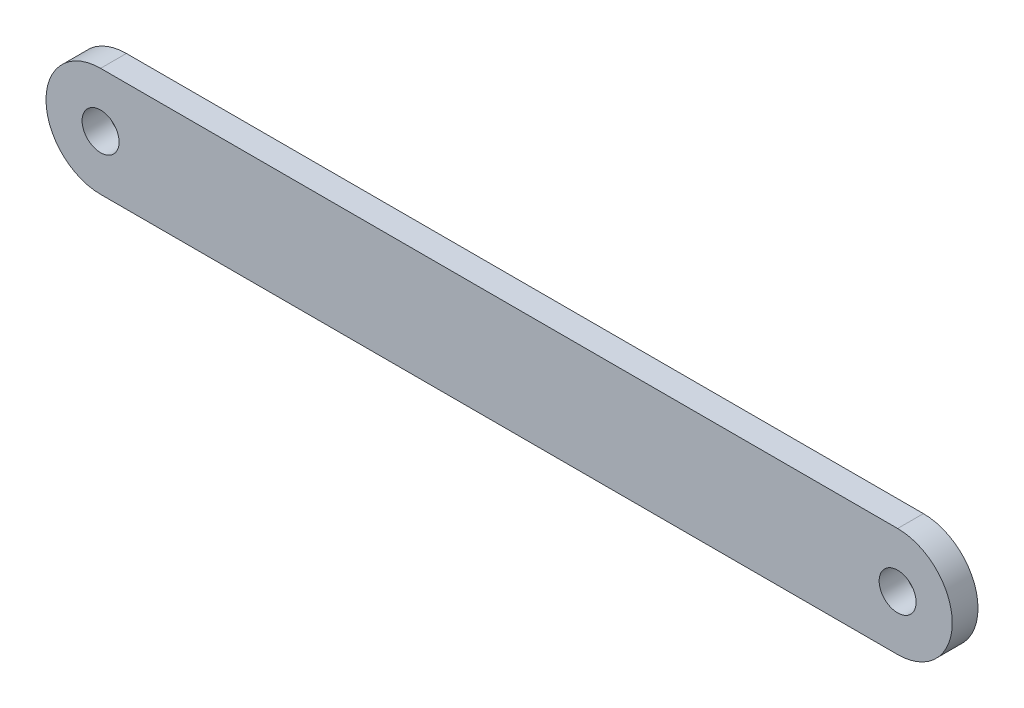
from build123d import *

# Parameters (mm, degrees)
BOSS_EXTRUDE1_DEPTH       = 2.9972
F_8_CLEARANCE_HOLE1_D     = 4.3053
F_8_CLEARANCE_HOLE1_DEPTH = 6.351016


with BuildPart() as part:
    # Sketch1 → Boss-Extrude1 (new body)
    with BuildSketch(Plane.XY):
        with BuildLine():
            Line((-46.355, 6.35), (46.355, 6.35))
            ThreePointArc((46.355, 6.35), (52.705, 0), (46.355, -6.35))
            Line((46.355, -6.35), (-46.355, -6.35))
            ThreePointArc((-46.355, -6.35), (-52.705, 0), (-46.355, 6.35))
        make_face()
    extrude(amount=BOSS_EXTRUDE1_DEPTH)

    # #8 Clearance Hole1
    with Locations(Plane.XY.offset(2.9972)):
        with Locations((-46.355, 0), (46.355, 0)):
            Hole(F_8_CLEARANCE_HOLE1_D / 2, depth=F_8_CLEARANCE_HOLE1_DEPTH)


solid = part.part
